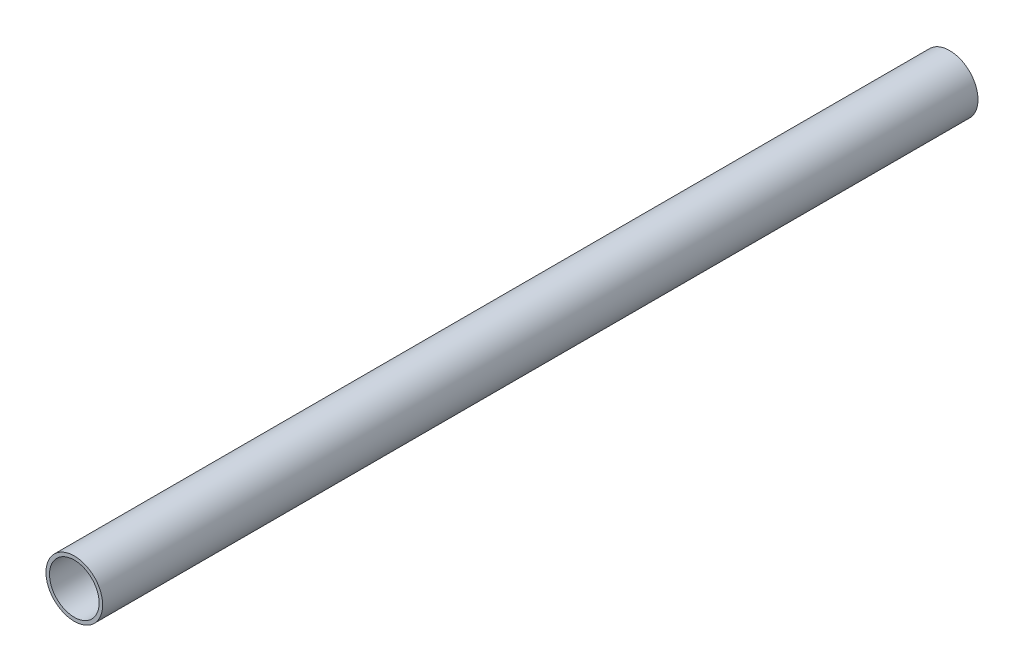
from build123d import *

# Parameters (mm, degrees)
SKETCH1_R           = 8
SKETCH1_R_2         = 7
BOSS_EXTRUDE1_DEPTH = 247


with BuildPart() as part:
    # Sketch1 → Boss-Extrude1 (new body)
    with BuildSketch(Plane.XY):
        Circle(SKETCH1_R)
        Circle(SKETCH1_R_2, mode=Mode.SUBTRACT)
    extrude(amount=BOSS_EXTRUDE1_DEPTH)


solid = part.part
